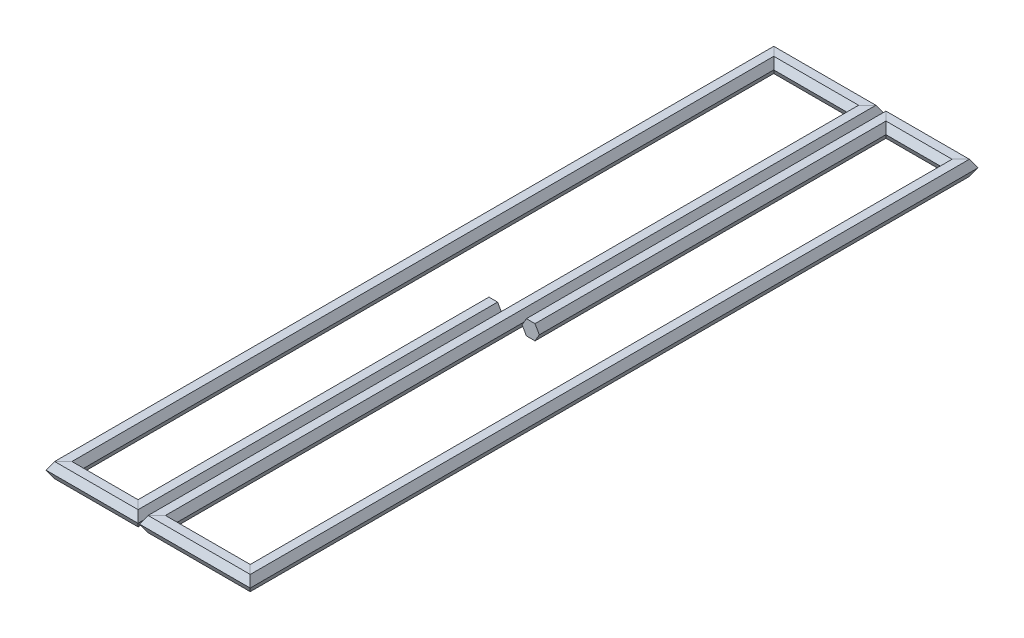
from build123d import *


with BuildPart() as part:
    # Sweep2: sweep along a path in Sketch2
    with BuildLine(Plane(origin=(0, 0, 0), x_dir=(1, 0, 0), z_dir=(0, 1, 0))) as sweep2_path:
        Line((-25, 0), (-25, -475))
        Line((-25, -475), (-125, -475))
        Line((-125, -475), (-125, 475))
        Line((-125, 475), (0, 475))
        Line((0, 475), (0, -475))
        Line((0, -475), (125, -475))
        Line((125, -475), (125, 475))
        Line((125, 475), (25, 475))
        Line((25, 475), (25, 0))
    # Sketch3 → Sweep2 (sweep)
    with BuildSketch(Plane.XY):
        Polygon((36.547005384, 0), (30.773502692, 10), (19.226497308, 10), (13.452994616, 0), (19.226497308, -10), (30.773502692, -10), align=None)
    sweep(path=sweep2_path.line, transition=Transition.RIGHT)


solid = part.part
